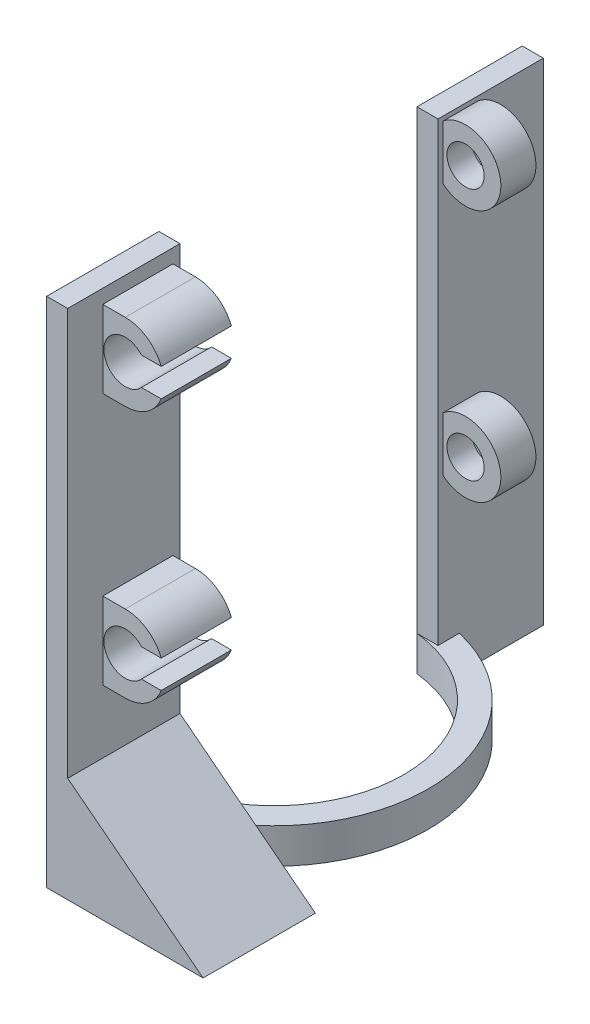
from build123d import *

# Parameters (mm, degrees)
BOSS_EXTRUDE1_DEPTH   = 10
BOSS_EXTRUDE1_2_DEPTH = 10
SKETCH2_W             = 16
SKETCH2_H             = 58
BOSS_EXTRUDE2_DEPTH   = 3
BOSS_EXTRUDE3_DEPTH   = 5
SKETCH5_W             = 3
SKETCH5_H             = 15
BOSS_EXTRUDE4_DEPTH   = 70
BOSS_EXTRUDE5_START   = 38.5
SKETCH7_R             = 5.029708881
BOSS_EXTRUDE5_DEPTH   = 5
SKETCH6_R             = 2.65
CUT_EXTRUDE1_DEPTH    = 42
SKETCH8_R             = 1
CUT_EXTRUDE2_DEPTH    = 1.5
LPATTERN1_COUNT       = 2
LPATTERN1_PITCH       = 36


with BuildPart() as part:
    # Sketch1 → Boss-Extrude1 (new body)
    with BuildSketch(Plane.XY):
        with BuildLine():
            Line((0, 5.5), (-3.199491128, 5.5))
            Line((-3.199491128, 5.5), (-3.199491128, -5.5))
            Line((-3.199491128, -5.5), (0, -5.5))
            ThreePointArc((0, -5.5), (3.102418411, -4.541475531), (5.123475383, -2))
            Line((5.123475383, -2), (2.302715788, -2))
            ThreePointArc((2.302715788, -2), (-3.05, 0), (2.302715788, 2))
            Line((2.302715788, 2), (5.123475383, 2))
            ThreePointArc((5.123475383, 2), (3.102418411, 4.541475531), (0, 5.5))
        make_face()
    extrude(amount=BOSS_EXTRUDE1_DEPTH)



with BuildPart() as body_2:
    # Sketch1 → Boss-Extrude1 2 (new body)
    with BuildSketch(Plane.XY):
        with BuildLine():
            Line((2.302715788, -34), (5.123475383, -34))
            ThreePointArc((5.123475383, -34), (3.102418411, -31.458524469), (0, -30.5))
            Line((0, -30.5), (-3.199491128, -30.5))
            Line((-3.199491128, -30.5), (-3.199491128, -41.5))
            Line((-3.199491128, -41.5), (0, -41.5))
            ThreePointArc((0, -41.5), (3.102418411, -40.541475531), (5.123475383, -38))
            Line((5.123475383, -38), (2.302715788, -38))
            ThreePointArc((2.302715788, -38), (-3.05, -36), (2.302715788, -34))
        make_face()
    extrude(amount=BOSS_EXTRUDE1_2_DEPTH)


with BuildPart() as part_1:
    add(part.part)

    add(body_2.part)  # Boss-Extrude2 merges body 2
    # Sketch2 → Boss-Extrude2 (add)
    with BuildSketch(Plane.ZY.offset(3.199491128)):
        with Locations((7, -21.5)):
            Rectangle(SKETCH2_W, SKETCH2_H)
    extrude(amount=BOSS_EXTRUDE2_DEPTH)

    # Sketch3 → section 1 of loft1
    with BuildSketch(Plane(origin=(0, -65.5, 0), x_dir=(-1, 0, 0), z_dir=(0, -1, 0)), mode=Mode.PRIVATE) as loft1_s1:
        with BuildLine():
            Line((6.199491128, 1), (-16.09430114, 1))
            Line((-16.09430114, 1), (-16.09430114, -15))
            Line((-16.09430114, -15), (6.199491128, -15))
            Line((6.199491128, -15), (6.199491128, 1))
        make_face()
    # loft from a face of the part (loft1)
    loft([part_1.faces().sort_by_distance((-4.699491128, -50.5, 7))[0], loft1_s1.sketch])


with BuildPart() as body_2_2:
    # Sketch4 → Boss-Extrude3 (new body)
    with BuildSketch(Plane.XZ.offset(65.5)):
        with BuildLine():
            Line((-6.199491128, 2.517328142), (-6.199491128, -1))
            ThreePointArc((-6.199491128, -1), (10.300508872, -19.391574158), (-6.199491128, -37.783148315))
            Line((-6.199491128, -37.783148315), (-6.199491128, -41.300476458))
            ThreePointArc((-6.199491128, -41.300476458), (13.800508872, -19.391574158), (-6.199491128, 2.517328142))
        make_face()
    extrude(amount=-BOSS_EXTRUDE3_DEPTH)

    # Sketch5 → Boss-Extrude4 (add)
    with BuildSketch(Plane.XZ.offset(65.5)):
        with Locations((-4.699491128, -45.283148315)):
            Rectangle(SKETCH5_W, SKETCH5_H)
    extrude(amount=-BOSS_EXTRUDE4_DEPTH)


with BuildPart() as body_3:
    # Sketch7 → Boss-Extrude5 (new body)
    with BuildSketch(Plane(origin=(0, 0, 0), x_dir=(-1, 0, 0), z_dir=(0, 0, -1)).offset(BOSS_EXTRUDE5_START)):
        Circle(SKETCH7_R)
    extrude(amount=BOSS_EXTRUDE5_DEPTH)

    # Sketch6 → Cut-Extrude1 (cut)
    with BuildSketch(Plane(origin=(0, 0, 0), x_dir=(-1, 0, 0), z_dir=(0, 0, -1))):
        with Locations(Location((0, 0, 0), (0, 0, 180))):
            Circle(SKETCH6_R)
    extrude(amount=CUT_EXTRUDE1_DEPTH, mode=Mode.SUBTRACT)

    # Sketch8 → Cut-Extrude2 (cut)
    with BuildSketch(Plane.XY.offset(-42)):
        with Locations((-1.5, 0)):
            Circle(SKETCH8_R)
        with Locations((1.5, 0)):
            Circle(SKETCH8_R)
    extrude(amount=-CUT_EXTRUDE2_DEPTH, mode=Mode.SUBTRACT)


with BuildPart() as lpattern1_1:
    # LPattern1: pattern copy
    add(body_3.part.moved(Location(Vector(0, -1, 0) * (1 * LPATTERN1_PITCH))))


solid = Compound([part_1.part, body_2_2.part, body_3.part, lpattern1_1.part])
